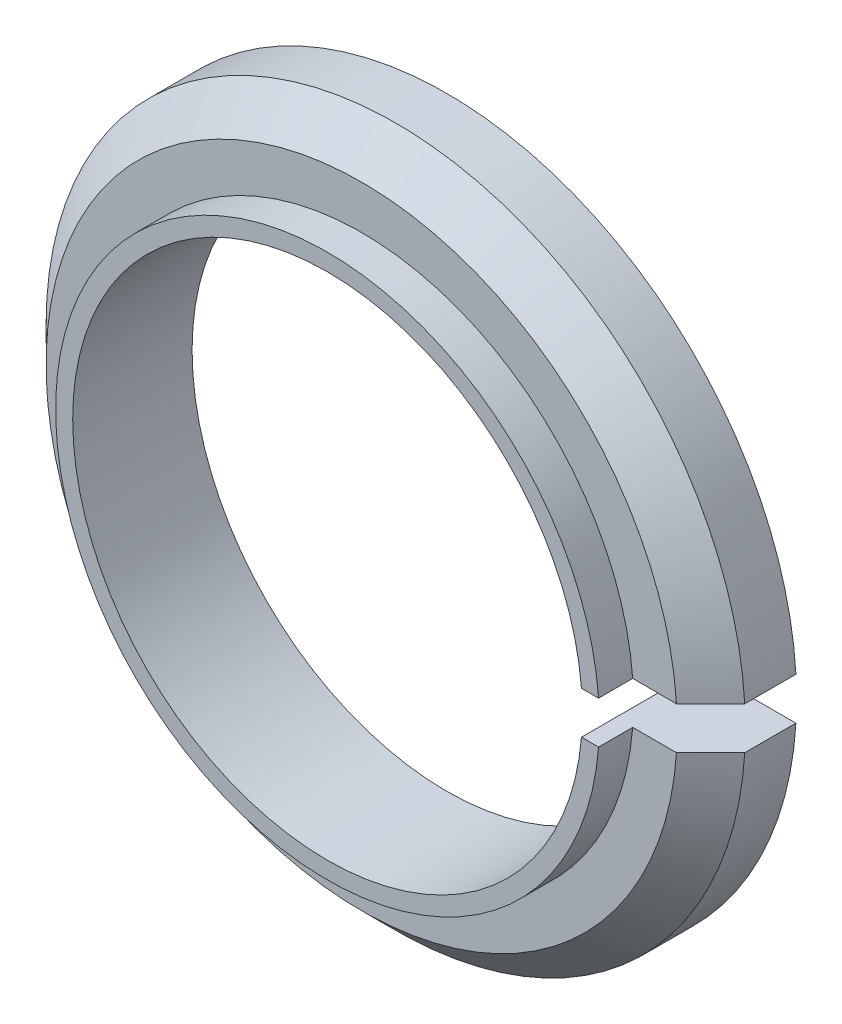
from build123d import *

# Parameters (mm, degrees)
SKETCH1_R           = 15.94
SKETCH1_R_2         = 14.94
BOSS_EXTRUDE1_DEPTH = 7
SKETCH1_3_R         = 20.5
SKETCH1_3_R_2       = 15.94
BOSS_EXTRUDE2_DEPTH = 5
CHAMFER1_SIZE       = 2
SKETCH2_W           = 8
SKETCH2_H           = 2.482498026
CUT_EXTRUDE1_DEPTH  = 13


with BuildPart() as part:
    # Sketch1 → Boss-Extrude1 (new body)
    with BuildSketch(Plane.XY):
        Circle(SKETCH1_R)
        Circle(SKETCH1_R_2, mode=Mode.SUBTRACT)
    extrude(amount=BOSS_EXTRUDE1_DEPTH)

    # Sketch1<3> → Boss-Extrude2 (add)
    with BuildSketch(Plane.XY):
        Circle(SKETCH1_3_R)
        Circle(SKETCH1_3_R_2, mode=Mode.SUBTRACT)
    extrude(amount=BOSS_EXTRUDE2_DEPTH)

    # Chamfer1
    chamfer1_edges = [part.edges().sort_by_distance(p)[0] for p in [
        (-20.5, 0, 5),
    ]]
    chamfer(chamfer1_edges, length=CHAMFER1_SIZE)

    # Sketch2 → Cut-Extrude1 (cut)
    with BuildSketch(Plane(origin=(20.5, 0, 0), x_dir=(0, 0, -1), z_dir=(1, 0, 0))):
        with Locations((-3, 0)):
            Rectangle(SKETCH2_W, SKETCH2_H)
    extrude(amount=-CUT_EXTRUDE1_DEPTH, mode=Mode.SUBTRACT)


solid = part.part
